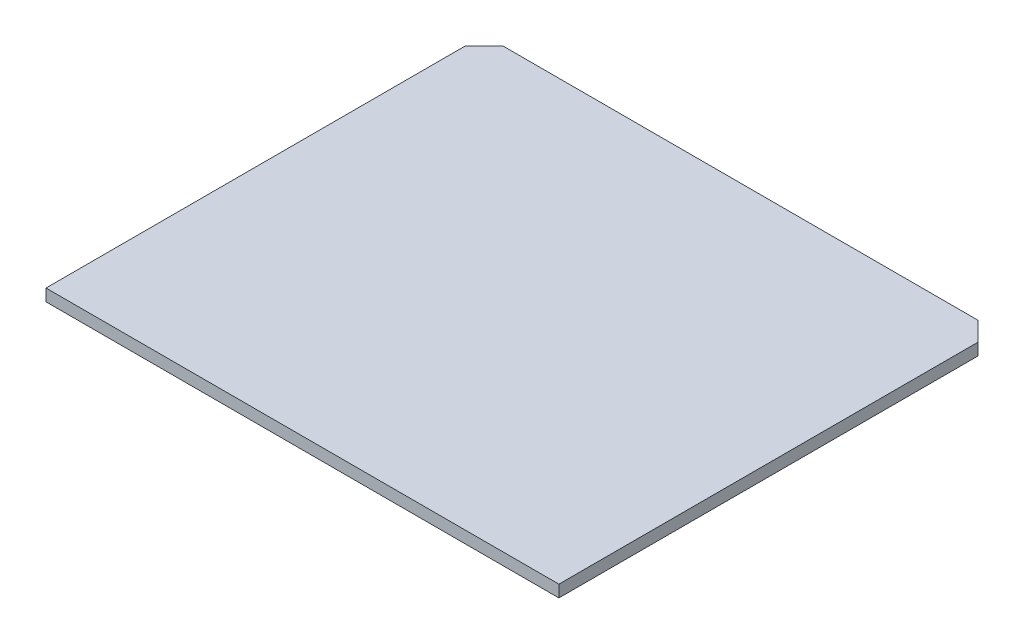
from build123d import *

# Parameters (mm, degrees)
SKETCH1_W           = 68.58
SKETCH1_H           = 58.58
BOSS_EXTRUDE1_DEPTH = 1.6
CHAMFER1_SIZE       = 2.54


with BuildPart() as part:
    # Sketch1 → Boss-Extrude1 (new body)
    with BuildSketch(Plane(origin=(0, 0, 0), x_dir=(1, 0, 0), z_dir=(0, 1, 0))):
        Rectangle(SKETCH1_W, SKETCH1_H)
    extrude(amount=BOSS_EXTRUDE1_DEPTH)

    # Chamfer1
    chamfer1_edges = [part.edges().sort_by_distance(p)[0] for p in [
        (-34.29, 0.8, -29.29),
        (34.29, 0.8, -29.29),
    ]]
    chamfer(chamfer1_edges, length=CHAMFER1_SIZE)


solid = part.part
